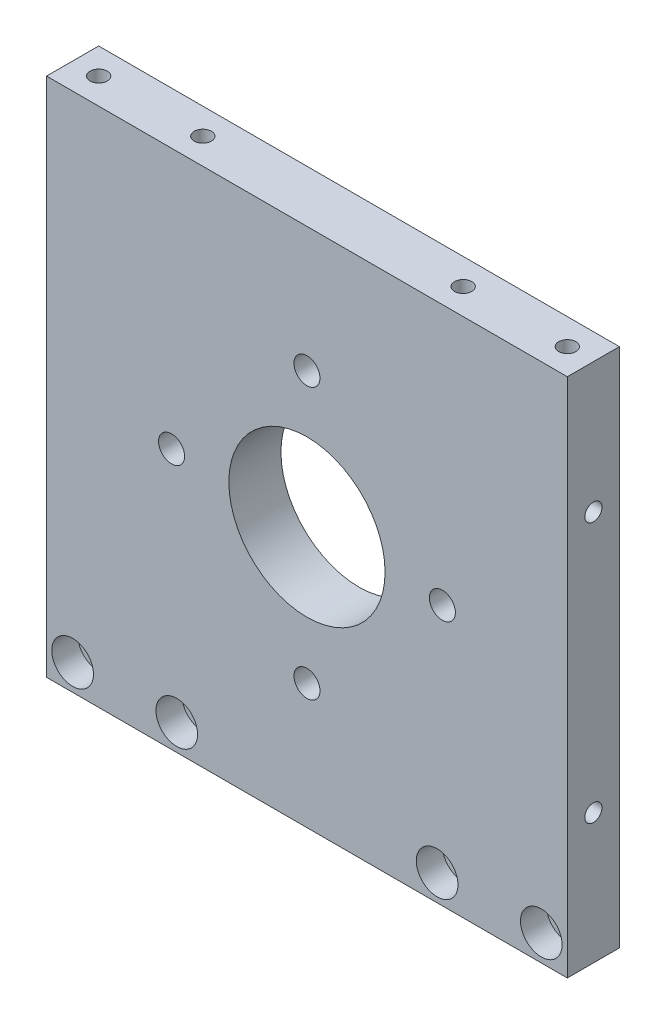
from build123d import *

# Parameters (mm, degrees)
SKETCH1_W                                           = 10
SKETCH1_H                                           = 100
BOSS_EXTRUDE1_DEPTH                                 = 50
SKETCH2_R                                           = 15
CUT_EXTRUDE1_DEPTH                                  = 10
CBORE_FOR_M4_HEX_SOCKET_HEAD_CAP_SCREW1_D           = 4.5
CBORE_FOR_M4_HEX_SOCKET_HEAD_CAP_SCREW1_CBORE_D     = 8
CBORE_FOR_M4_HEX_SOCKET_HEAD_CAP_SCREW1_CBORE_DEPTH = 5
M4_TAPPED_HOLE1_D                                   = 3.3
M4_TAPPED_HOLE1_DEPTH                               = 11
M4_TAPPED_HOLE1_TIP                                 = 0.991420021
M4_TAPPED_HOLE2_D                                   = 3.3
M4_TAPPED_HOLE2_DEPTH                               = 11
M4_TAPPED_HOLE2_TIP                                 = 0.991420021
M4_TAPPED_HOLE3_D                                   = 3.3
M4_TAPPED_HOLE3_DEPTH                               = 11
M4_TAPPED_HOLE3_TIP                                 = 0.991420021
M6_TAPPED_HOLE1_D                                   = 5


with BuildPart() as part:
    # Sketch1 → Boss-Extrude1 (new, symmetric)
    with BuildSketch(Plane(origin=(0, 0, 0), x_dir=(0, 0, -1), z_dir=(1, 0, 0))):
        Rectangle(SKETCH1_W, SKETCH1_H)
    extrude(amount=BOSS_EXTRUDE1_DEPTH, both=True)

    # Sketch2 → Cut-Extrude1 (cut)
    with BuildSketch(Plane.XY.offset(5)):
        Circle(SKETCH2_R)
    extrude(amount=-CUT_EXTRUDE1_DEPTH, mode=Mode.SUBTRACT)

    # CBORE for M4 Hex Socket Head Cap Screw1 (through all)
    with Locations(Plane.XY.offset(5)):
        with Locations((-45, -45), (-25, -45), (25, -45), (45, -45)):
            CounterBoreHole(CBORE_FOR_M4_HEX_SOCKET_HEAD_CAP_SCREW1_D / 2, CBORE_FOR_M4_HEX_SOCKET_HEAD_CAP_SCREW1_CBORE_D / 2, CBORE_FOR_M4_HEX_SOCKET_HEAD_CAP_SCREW1_CBORE_DEPTH)

    # M4 Tapped Hole1
    with Locations(Plane(origin=(0, 50, 0), x_dir=(1, 0, 0), z_dir=(0, 1, 0))):
        with Locations((-45, 0), (-25, 0), (25, 0), (45, 0)):
            Hole(M4_TAPPED_HOLE1_D / 2, depth=M4_TAPPED_HOLE1_DEPTH)
            with Locations((0, 0, -(M4_TAPPED_HOLE1_DEPTH + M4_TAPPED_HOLE1_TIP / 2))):  # 118° drill point
                Cone(0, M4_TAPPED_HOLE1_D / 2, M4_TAPPED_HOLE1_TIP, mode=Mode.SUBTRACT)

    # M4 Tapped Hole2
    with Locations(Plane.ZY.offset(50)):
        with Locations((0, 25), (0, -25)):
            Hole(M4_TAPPED_HOLE2_D / 2, depth=M4_TAPPED_HOLE2_DEPTH)
            with Locations((0, 0, -(M4_TAPPED_HOLE2_DEPTH + M4_TAPPED_HOLE2_TIP / 2))):  # 118° drill point
                Cone(0, M4_TAPPED_HOLE2_D / 2, M4_TAPPED_HOLE2_TIP, mode=Mode.SUBTRACT)

    # M4 Tapped Hole3
    with Locations(Plane(origin=(50, 0, 0), x_dir=(0, 0, -1), z_dir=(1, 0, 0))):
        with Locations((0, 25), (0, -25)):
            Hole(M4_TAPPED_HOLE3_D / 2, depth=M4_TAPPED_HOLE3_DEPTH)
            with Locations((0, 0, -(M4_TAPPED_HOLE3_DEPTH + M4_TAPPED_HOLE3_TIP / 2))):  # 118° drill point
                Cone(0, M4_TAPPED_HOLE3_D / 2, M4_TAPPED_HOLE3_TIP, mode=Mode.SUBTRACT)

    # M6 Tapped Hole1 (through all)
    with Locations(Plane.XY.offset(5)):
        with Locations((0, 26), (-26, 0), (26, 0), (0, -26)):
            Hole(M6_TAPPED_HOLE1_D / 2)


solid = part.part
